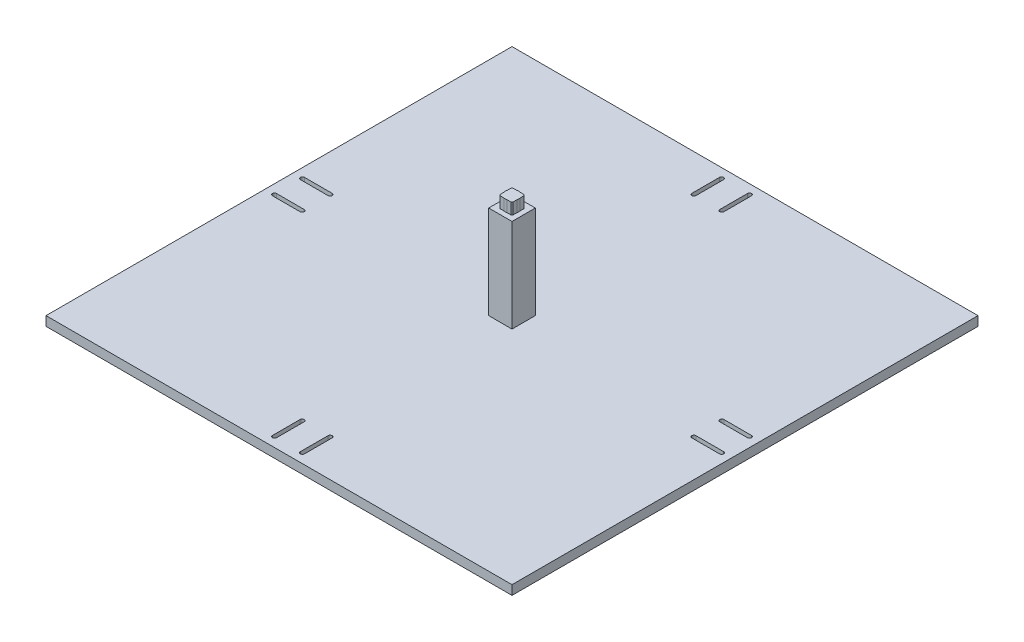
from build123d import *

# Parameters (mm, degrees)
ESBO_O1_W                  = 500
ESBO_O1_H                  = 500
RESSALTO_EXTRUS_O1_DEPTH   = 10
CORTE_EXTRUS_O2_DEPTH      = 708.177488329
CORTE_EXTRUS_O2_DEPTH_BACK = 708.177488329
ESBO_O3_W                  = 25
ESBO_O3_H                  = 25
RESSALTO_EXTRUS_O2_DEPTH   = 100
ESBO_O4_W                  = 14
ESBO_O4_H                  = 14
RESSALTO_EXTRUS_O3_DEPTH   = 12
ESBO_O5_R                  = 7.24
RESSALTO_EXTRUS_O4_DEPTH   = 12
CHANFRO1_SIZE              = 1


with BuildPart() as part:
    # Esboço1 → Ressalto-extrusão1 (new body)
    with BuildSketch(Plane(origin=(0, 0, 0), x_dir=(1, 0, 0), z_dir=(0, 1, 0))):
        with Locations((250, 250)):
            Rectangle(ESBO_O1_W, ESBO_O1_H)
    extrude(amount=RESSALTO_EXTRUS_O1_DEPTH)

    # Esboço2 → Corte-extrusão2 (cut, two sides: drawn at the far end of the back side and taken through both)
    with BuildSketch(Plane(origin=(0, 10, 0), x_dir=(1, 0, 0), z_dir=(0, 1, 0)).offset(-CORTE_EXTRUS_O2_DEPTH_BACK)):
        with BuildLine():
            Line((232.85, 489.85), (232.85, 460.15))
            ThreePointArc((232.85, 460.15), (235, 458), (237.15, 460.15))
            Line((237.15, 460.15), (237.15, 489.85))
            ThreePointArc((237.15, 489.85), (235, 492), (232.85, 489.85))
        make_face()
        with BuildLine():
            Line((262.85, 489.85), (262.85, 460.15))
            ThreePointArc((262.85, 460.15), (265, 458), (267.15, 460.15))
            Line((267.15, 460.15), (267.15, 489.85))
            ThreePointArc((267.15, 489.85), (265, 492), (262.85, 489.85))
        make_face()
        with BuildLine():
            Line((489.85, 267.15), (460.15, 267.15))
            ThreePointArc((460.15, 267.15), (458, 265), (460.15, 262.85))
            Line((460.15, 262.85), (489.85, 262.85))
            ThreePointArc((489.85, 262.85), (492, 265), (489.85, 267.15))
        make_face()
        with BuildLine():
            Line((489.85, 237.15), (460.15, 237.15))
            ThreePointArc((460.15, 237.15), (458, 235), (460.15, 232.85))
            Line((460.15, 232.85), (489.85, 232.85))
            ThreePointArc((489.85, 232.85), (492, 235), (489.85, 237.15))
        make_face()
        with BuildLine():
            Line((267.15, 10.15), (267.15, 39.85))
            ThreePointArc((267.15, 39.85), (265, 42), (262.85, 39.85))
            Line((262.85, 39.85), (262.85, 10.15))
            ThreePointArc((262.85, 10.15), (265, 8), (267.15, 10.15))
        make_face()
        with BuildLine():
            Line((237.15, 10.15), (237.15, 39.85))
            ThreePointArc((237.15, 39.85), (235, 42), (232.85, 39.85))
            Line((232.85, 39.85), (232.85, 10.15))
            ThreePointArc((232.85, 10.15), (235, 8), (237.15, 10.15))
        make_face()
        with BuildLine():
            Line((10.15, 232.85), (39.85, 232.85))
            ThreePointArc((39.85, 232.85), (42, 235), (39.85, 237.15))
            Line((39.85, 237.15), (10.15, 237.15))
            ThreePointArc((10.15, 237.15), (8, 235), (10.15, 232.85))
        make_face()
        with BuildLine():
            Line((10.15, 262.85), (39.85, 262.85))
            ThreePointArc((39.85, 262.85), (42, 265), (39.85, 267.15))
            Line((39.85, 267.15), (10.15, 267.15))
            ThreePointArc((10.15, 267.15), (8, 265), (10.15, 262.85))
        make_face()
    extrude(amount=CORTE_EXTRUS_O2_DEPTH + CORTE_EXTRUS_O2_DEPTH_BACK, mode=Mode.SUBTRACT)

    # Esboço3 → Ressalto-extrusão2 (add)
    with BuildSketch(Plane(origin=(0, 10, 0), x_dir=(1, 0, 0), z_dir=(0, 1, 0))):
        with Locations((250, 250)):
            Rectangle(ESBO_O3_W, ESBO_O3_H)
    extrude(amount=RESSALTO_EXTRUS_O2_DEPTH)

    # Esboço4 → Ressalto-extrusão3 (add)
    with BuildSketch(Plane(origin=(0, 110, 0), x_dir=(1, 0, 0), z_dir=(0, 1, 0))):
        with Locations((250, 250)):
            Rectangle(ESBO_O4_W, ESBO_O4_H)
    extrude(amount=RESSALTO_EXTRUS_O3_DEPTH)

    # Esboço5 → Ressalto-extrusão4 (add)
    with BuildSketch(Plane(origin=(0, 122, 0), x_dir=(1, 0, 0), z_dir=(0, 1, 0))):
        with Locations((250, 250)):
            Circle(ESBO_O5_R)
    extrude(amount=-RESSALTO_EXTRUS_O4_DEPTH)

    # Chanfro1
    chanfro1_edges = [part.edges().sort_by_distance(p)[0] for p in [
        (243, 116, -257),
        (243, 116, -243),
        (257, 116, -243),
        (257, 116, -257),
    ]]
    chamfer(chanfro1_edges, length=CHANFRO1_SIZE)


solid = part.part
